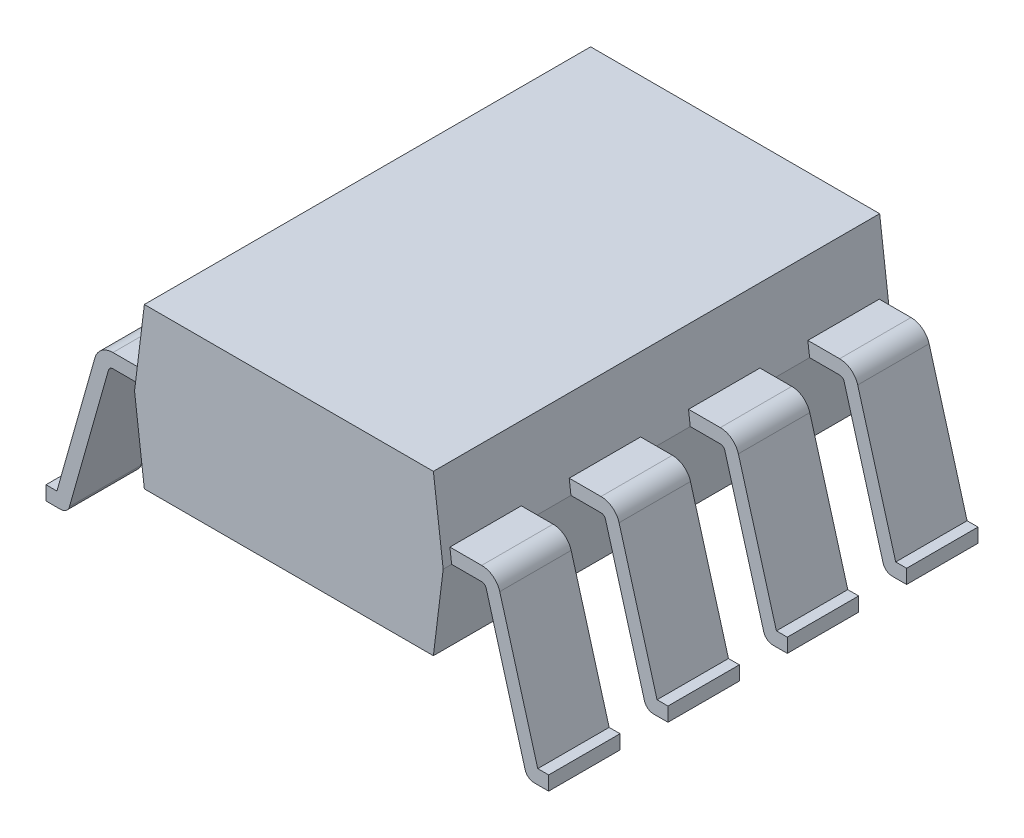
from build123d import *

# Parameters (mm, degrees)
BOSS_EXTRUDE1_DEPTH  = 4.75
BOSS_EXTRUDE2_DEPTH  = 0.76
LPATTERN1_COUNT      = 3
LPATTERN1_PITCH      = 2.54
LPATTERN1_COUNT_DIR2 = 2
LPATTERN1_PITCH_DIR2 = 2.54


with BuildPart() as part:
    # Sketch1 → Boss-Extrude1 (new, symmetric)
    with BuildSketch(Plane.XY):
        Polygon((3.076266246, 1.7), (-3.076266246, 1.7), (-3.285, 0), (-3.076266246, -1.7), (3.076266246, -1.7), (3.285, 0), align=None)
    extrude(amount=BOSS_EXTRUDE1_DEPTH, both=True)

    # Sketch2 → Boss-Extrude2 (add, symmetric)
    with BuildSketch(Plane.XY.offset(1.27)):
        with BuildLine():
            Line((3.924366416, 0.3), (-3.924366416, 0.3))
            ThreePointArc((-3.924366416, 0.3), (-4.16565809, 0.219027159), (-4.309259402, 0.008891642))
            Line((-4.309259402, 0.008891642), (-5.118080076, -2.85))
            Line((-5.118080076, -2.85), (-5.35, -2.85))
            Line((-5.35, -2.85), (-5.35, -3.15))
            Line((-5.35, -3.15), (-5.042446493, -3.15))
            ThreePointArc((-5.042446493, -3.15), (-4.921800656, -3.10951358), (-4.85, -3.004445821))
            Line((-4.85, -3.004445821), (-4.020589663, -0.07277709))
            ThreePointArc((-4.020589663, -0.07277709), (-3.984689335, -0.02024321), (-3.924366416, 0))
            Line((-3.924366416, 0), (3.924366416, 0))
            ThreePointArc((3.924366416, 0), (3.984689335, -0.02024321), (4.020589663, -0.07277709))
            Line((4.020589663, -0.07277709), (4.85, -3.004445821))
            ThreePointArc((4.85, -3.004445821), (4.921800656, -3.10951358), (5.042446493, -3.15))
            Line((5.042446493, -3.15), (5.35, -3.15))
            Line((5.35, -3.15), (5.35, -2.85))
            Line((5.35, -2.85), (5.118080076, -2.85))
            Line((5.118080076, -2.85), (4.309259402, 0.008891642))
            ThreePointArc((4.309259402, 0.008891642), (4.16565809, 0.219027159), (3.924366416, 0.3))
        make_face()
    boss_extrude2 = extrude(amount=BOSS_EXTRUDE2_DEPTH, both=True)

    # LPattern1: Boss-Extrude2 3 × 2
    with Locations(*[Vector(0, 0, -1) * (i * LPATTERN1_PITCH) + Vector(0, 0, 1) * (j * LPATTERN1_PITCH_DIR2) for i in range(LPATTERN1_COUNT) for j in range(LPATTERN1_COUNT_DIR2) if (i, j) != (0, 0)]):
        add(boss_extrude2)


solid = part.part
